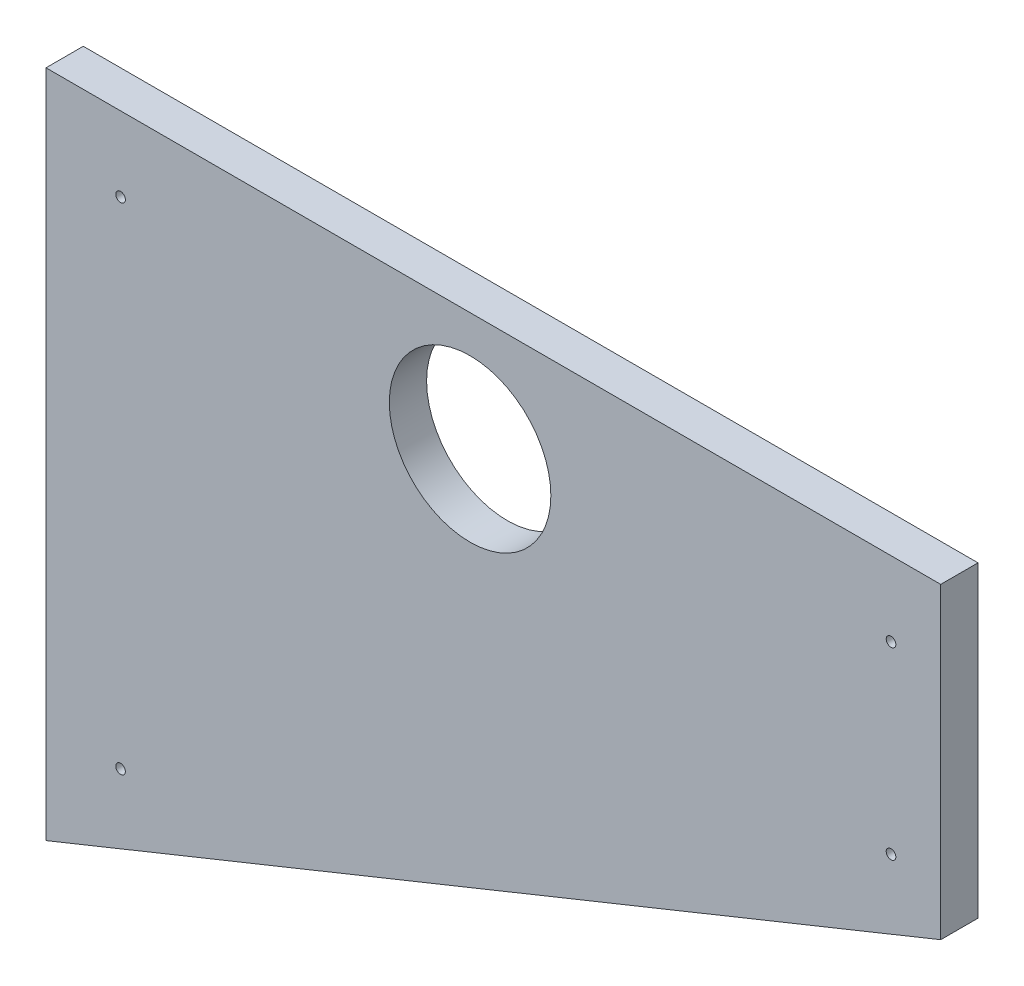
from build123d import *

# Parameters (mm, degrees)
BOSS_EXTRUDE1_DEPTH                               = 19.05
CSK_FOR_8_FLAT_HEAD_MACHINE_SCREW_100_D           = 4.9149
CSK_FOR_8_FLAT_HEAD_MACHINE_SCREW_100_CSINK_D     = 8.4328
CSK_FOR_8_FLAT_HEAD_MACHINE_SCREW_100_CSINK_ANGLE = 100
SKETCH4_R                                         = 41.275
CUT_EXTRUDE1_DEPTH                                = 19.05


with BuildPart() as part:
    # Sketch1 → Boss-Extrude1 (new body)
    with BuildSketch(Plane.XY):
        Polygon((2683.51, 6983.72999014), (2683.51, 6641.741886848), (3140.71, 6826.4626773), (3140.71, 6983.72999014), align=None)
    extrude(amount=BOSS_EXTRUDE1_DEPTH)

    # CSK for #8 Flat Head Machine Screw (100)1 (through all)
    with Locations(Plane.YX):
        with Locations((6692.541891629, 2721.610000001), (6945.629994921, 2721.610000001), (6945.629994921, 3115.310000001), (6851.60701674, 3115.310000001)):
            CounterSinkHole(CSK_FOR_8_FLAT_HEAD_MACHINE_SCREW_100_D / 2, CSK_FOR_8_FLAT_HEAD_MACHINE_SCREW_100_CSINK_D / 2, counter_sink_angle=CSK_FOR_8_FLAT_HEAD_MACHINE_SCREW_100_CSINK_ANGLE)

    # Sketch4 → Cut-Extrude1 (cut)
    with BuildSketch(Plane(origin=(0, 0, 0), x_dir=(-1, 0, 0), z_dir=(0, 0, -1))):
        with Locations((-2900.218040257, 6923.40499014)):
            Circle(SKETCH4_R)
    extrude(amount=-CUT_EXTRUDE1_DEPTH, mode=Mode.SUBTRACT)


solid = part.part
